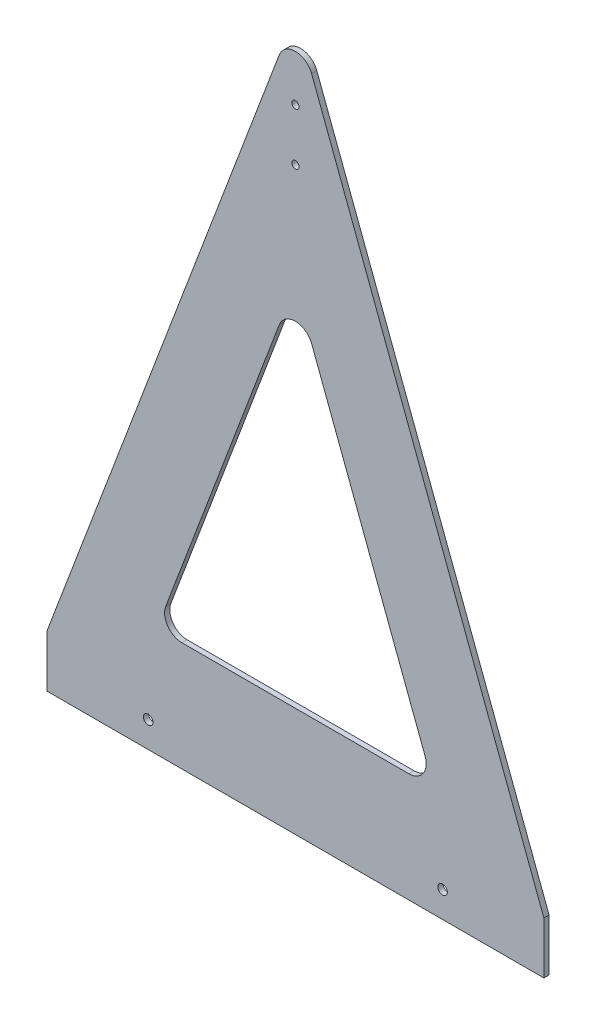
from build123d import *

# Parameters (mm, degrees)
CROQUIS1_R                   = 2.1
SALIENTE_EXTRUIR1_DEPTH      = 3
TALADRO_DE_MARGEN_PARA_M51_D = 5.5
CORTAR_EXTRUIR1_DEPTH        = 3


with BuildPart() as part:
    # Croquis1 → Saliente-Extruir1 (new body)
    with BuildSketch(Plane.XY):
        with BuildLine():
            Line((-143.5, 0), (143.5, 0))
            Line((143.5, 0), (143.5, 30))
            Line((143.5, 30), (9.355173022, 385.226719524))
            ThreePointArc((9.355173022, 385.226719524), (0, 391.693910765), (-9.355173022, 385.226719524))
            Line((-9.355173022, 385.226719524), (-143.5, 30))
            Line((-143.5, 30), (-143.5, 0))
        make_face()
        with Locations((0, 365)):
            Circle(CROQUIS1_R, mode=Mode.SUBTRACT)
        with Locations((0, 335)):
            Circle(CROQUIS1_R, mode=Mode.SUBTRACT)
    extrude(amount=SALIENTE_EXTRUIR1_DEPTH)

    # Taladro de margen para M51 (through all)
    with Locations(Plane(origin=(0, 0, 0), x_dir=(-1, 0, 0), z_dir=(0, 0, -1))):
        with Locations((-85, 15), (85, 15)):
            Hole(TALADRO_DE_MARGEN_PARA_M51_D / 2)

    # Croquis4 → Cortar-Extruir1 (cut)
    with BuildSketch(Plane(origin=(0, 0, 0), x_dir=(-1, 0, 0), z_dir=(0, 0, -1))):
        with BuildLine():
            Line((9.355173022, 250.226719524), (74.889584061, 76.686118864))
            ThreePointArc((74.889584061, 76.686118864), (73.760226731, 67.466838773), (65.534411039, 63.153310105))
            Line((65.534411039, 63.153310105), (-65.534411039, 63.153310105))
            ThreePointArc((-65.534411039, 63.153310105), (-73.760226731, 67.466838773), (-74.889584061, 76.686118864))
            Line((-74.889584061, 76.686118864), (-9.355173022, 250.226719524))
            ThreePointArc((-9.355173022, 250.226719524), (0, 256.693910765), (9.355173022, 250.226719524))
        make_face()
    extrude(amount=-CORTAR_EXTRUIR1_DEPTH, mode=Mode.SUBTRACT)


solid = part.part
